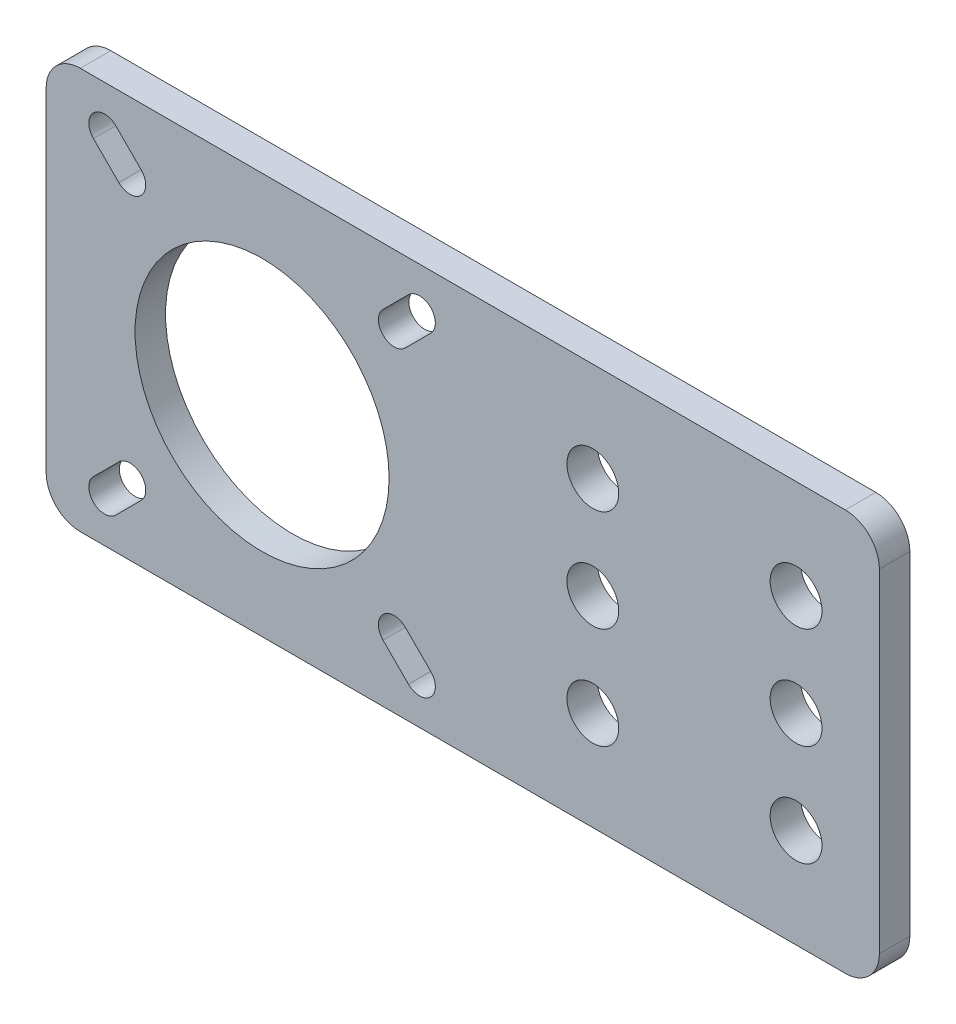
from build123d import *

# Parameters (mm, degrees)
ESQUISSE1_R        = 12.5
ESQUISSE1_R_2      = 2.55
BOSS_EXTRU_1_DEPTH = 1.5


with BuildPart() as part:
    # Esquisse1 → Boss.-Extru.1 (new, symmetric)
    with BuildSketch(Plane.XY):
        with BuildLine():
            Line((-37.64, -19.75), (37.64, -19.75))
            ThreePointArc((37.64, -19.75), (40.015878785, -18.765878785), (41, -16.39))
            Line((41, -16.39), (41, 16.39))
            ThreePointArc((41, 16.39), (40.015878785, 18.765878785), (37.64, 19.75))
            Line((37.64, 19.75), (-37.64, 19.75))
            ThreePointArc((-37.64, 19.75), (-40.015878785, 18.765878785), (-41, 16.39))
            Line((-41, 16.39), (-41, -16.39))
            ThreePointArc((-41, -16.39), (-40.015878785, -18.765878785), (-37.64, -19.75))
        make_face()
        with Locations((-19.75, 0)):
            Circle(ESQUISSE1_R, mode=Mode.SUBTRACT)
        with Locations((12.8, 10)):
            Circle(ESQUISSE1_R_2, mode=Mode.SUBTRACT)
        with Locations((32.8, 10)):
            Circle(ESQUISSE1_R_2, mode=Mode.SUBTRACT)
        with Locations((12.8, 0)):
            Circle(ESQUISSE1_R_2, mode=Mode.SUBTRACT)
        with Locations((32.8, 0)):
            Circle(ESQUISSE1_R_2, mode=Mode.SUBTRACT)
        with Locations((12.8, -10)):
            Circle(ESQUISSE1_R_2, mode=Mode.SUBTRACT)
        with Locations((32.8, -10)):
            Circle(ESQUISSE1_R_2, mode=Mode.SUBTRACT)
        with BuildLine():
            Line((-3.153984489, 14.403984489), (-5.653984489, 11.903984489))
            ThreePointArc((-5.653984489, 11.903984489), (-7.846015511, 11.903984489), (-7.846015511, 14.096015511))
            Line((-7.846015511, 14.096015511), (-5.346015511, 16.596015511))
            ThreePointArc((-5.346015511, 16.596015511), (-3.153984489, 16.596015511), (-3.153984489, 14.403984489))
        make_face(mode=Mode.SUBTRACT)
        with BuildLine():
            Line((-5.346015511, -16.596015511), (-7.846015511, -14.096015511))
            ThreePointArc((-7.846015511, -14.096015511), (-7.846015511, -11.903984489), (-5.653984489, -11.903984489))
            Line((-5.653984489, -11.903984489), (-3.153984489, -14.403984489))
            ThreePointArc((-3.153984489, -14.403984489), (-3.153984489, -16.596015511), (-5.346015511, -16.596015511))
        make_face(mode=Mode.SUBTRACT)
        with BuildLine():
            Line((-36.346015511, -14.403984489), (-33.846015511, -11.903984489))
            ThreePointArc((-33.846015511, -11.903984489), (-31.653984489, -11.903984489), (-31.653984489, -14.096015511))
            Line((-31.653984489, -14.096015511), (-34.153984489, -16.596015511))
            ThreePointArc((-34.153984489, -16.596015511), (-36.346015511, -16.596015511), (-36.346015511, -14.403984489))
        make_face(mode=Mode.SUBTRACT)
        with BuildLine():
            Line((-34.153984489, 16.596015511), (-31.653984489, 14.096015511))
            ThreePointArc((-31.653984489, 14.096015511), (-31.653984489, 11.903984489), (-33.846015511, 11.903984489))
            Line((-33.846015511, 11.903984489), (-36.346015511, 14.403984489))
            ThreePointArc((-36.346015511, 14.403984489), (-36.346015511, 16.596015511), (-34.153984489, 16.596015511))
        make_face(mode=Mode.SUBTRACT)
    extrude(amount=BOSS_EXTRU_1_DEPTH, both=True)


solid = part.part
